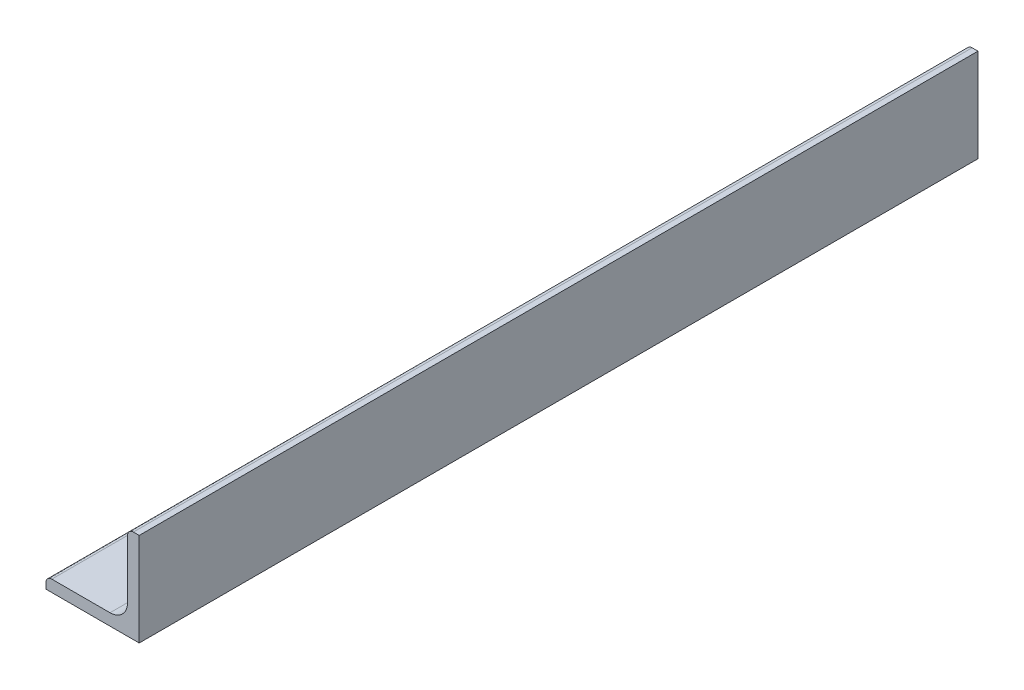
from build123d import *

# Parameters (mm, degrees)
BOSS_EXTRUDE1_DEPTH = 114.3


with BuildPart() as part:
    # Sketch2 → Boss-Extrude1 (new, symmetric)
    with BuildSketch(Plane.XY):
        with BuildLine():
            Line((-12.7, -12.7), (12.7, -12.7))
            Line((12.7, -12.7), (12.7, 12.7))
            Line((12.7, 12.7), (11.1125, 12.7))
            ThreePointArc((11.1125, 12.7), (9.989967985, 12.235032015), (9.525, 11.1125))
            Line((9.525, 11.1125), (9.525, -4.7498))
            ThreePointArc((9.525, -4.7498), (8.126376302, -8.126376302), (4.7498, -9.525))
            Line((4.7498, -9.525), (-11.1125, -9.525))
            ThreePointArc((-11.1125, -9.525), (-12.235032015, -9.989967985), (-12.7, -11.1125))
            Line((-12.7, -11.1125), (-12.7, -12.7))
        make_face()
    extrude(amount=BOSS_EXTRUDE1_DEPTH, both=True)


solid = part.part
